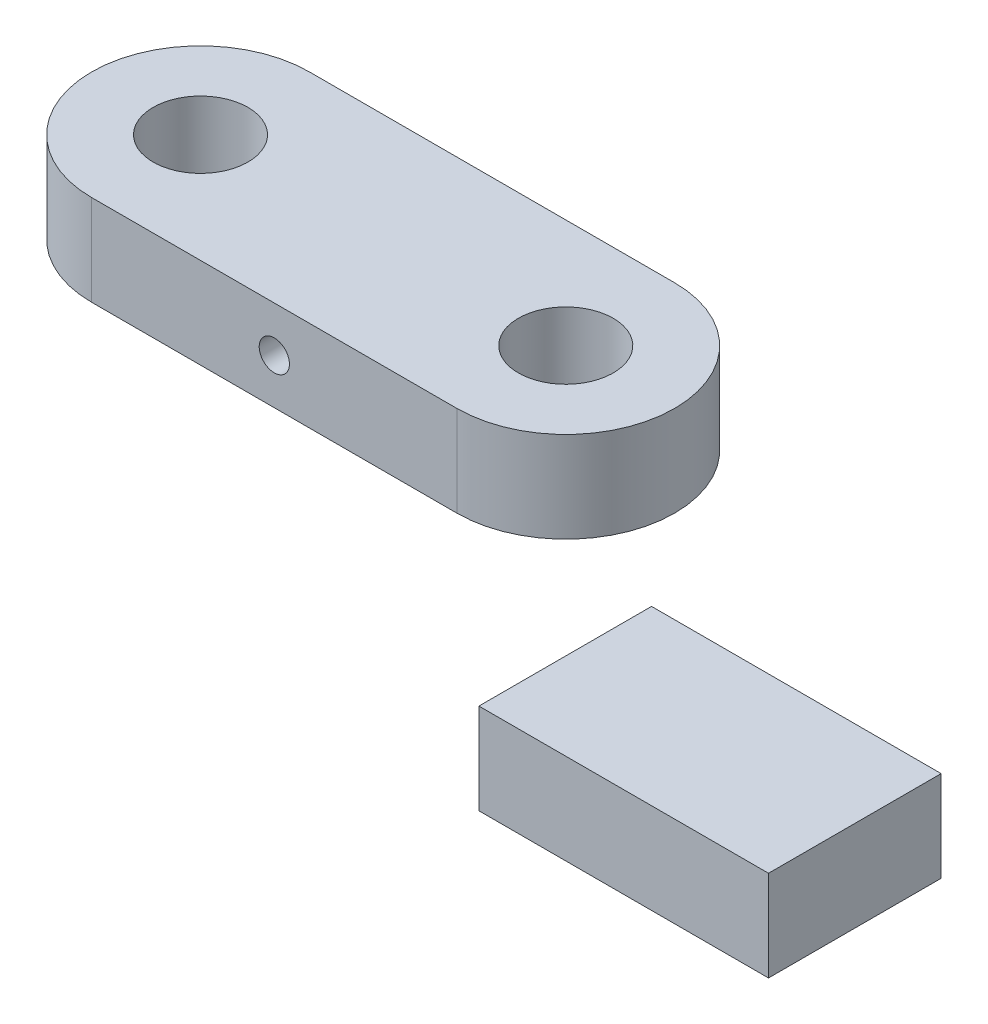
from build123d import *

# Parameters (mm, degrees)
SKETCH4_R               = 2.4892
BOSS_EXTRUDE1_DEPTH     = 4.7625
CUT_EXTRUDE4_DEPTH      = 28.801761999
CUT_EXTRUDE4_DEPTH_BACK = 28.801761999
SKETCH5_R               = 0.79375
SKETCH6_W               = 15.204282165
SKETCH6_H               = 9.063392152
BOSS_EXTRUDE2_DEPTH     = 4.7625


with BuildPart() as part:
    # Sketch4 → Boss-Extrude1 (new body)
    with BuildSketch(Plane(origin=(0, 0, 0), x_dir=(1, 0, 0), z_dir=(0, 1, 0))):
        with BuildLine():
            Line((0, 5.715), (19.177, 5.715))
            ThreePointArc((19.177, 5.715), (24.892, 0), (19.177, -5.715))
            Line((19.177, -5.715), (0, -5.715))
            ThreePointArc((0, -5.715), (-5.715, 0), (0, 5.715))
        make_face()
        with Locations(Location((0, 0, 0), (0, 0, 90))):
            Circle(SKETCH4_R, mode=Mode.SUBTRACT)
        with Locations(Location((19.177, 0, 0), (0, 0, 90))):
            Circle(SKETCH4_R, mode=Mode.SUBTRACT)
    extrude(amount=BOSS_EXTRUDE1_DEPTH)

    # Sketch5 → Cut-Extrude4 (cut, two sides: drawn at the far end of the back side and taken through both)
    with BuildSketch(Plane.XY.offset(5.715).offset(-CUT_EXTRUDE4_DEPTH_BACK)):
        with Locations((9.5885, 2.38125)):
            Circle(SKETCH5_R)
    extrude(amount=CUT_EXTRUDE4_DEPTH + CUT_EXTRUDE4_DEPTH_BACK, mode=Mode.SUBTRACT)


with BuildPart() as body_2:
    # Sketch6 → Boss-Extrude2 (new body)
    with BuildSketch(Plane.XZ):
        with Locations((40.887477958, 14.137829709)):
            Rectangle(SKETCH6_W, SKETCH6_H)
    extrude(amount=-BOSS_EXTRUDE2_DEPTH)


solid = Compound([part.part, body_2.part])
